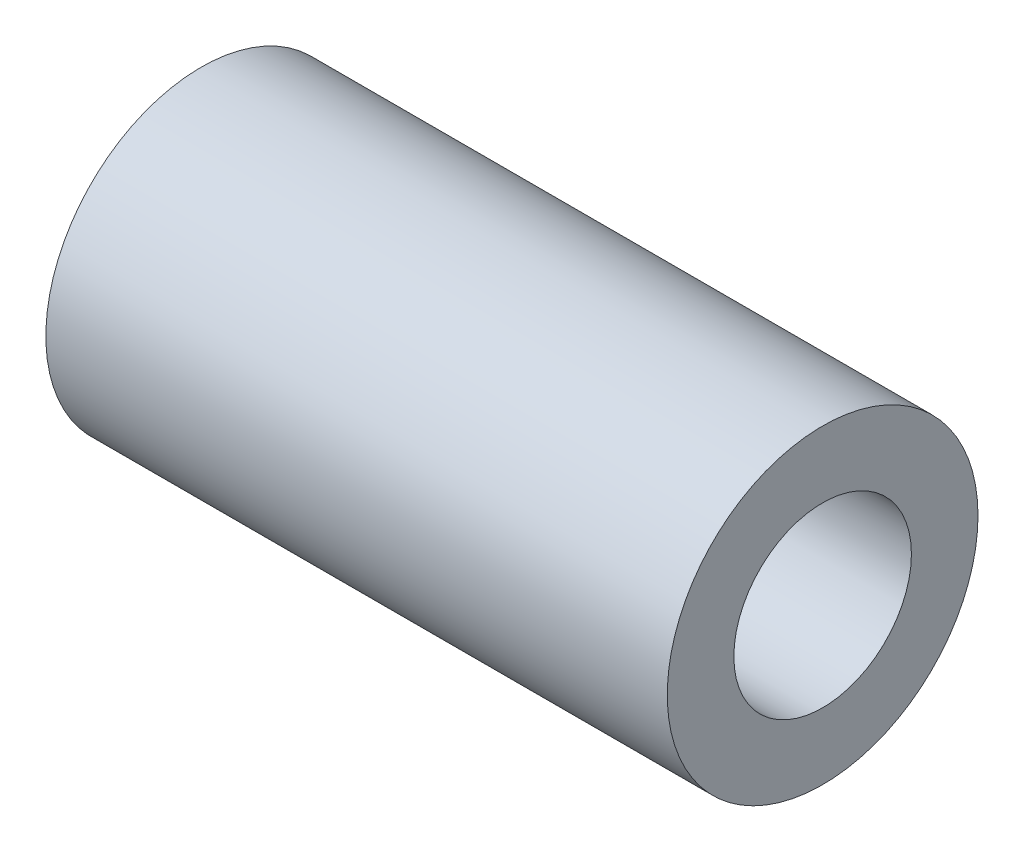
from build123d import *

# Parameters (mm, degrees)
SKETCH2_R           = 7
SKETCH2_R_2         = 4
BOSS_EXTRUDE1_DEPTH = 28


with BuildPart() as part:
    # Sketch2 → Boss-Extrude1 (new body)
    with BuildSketch(Plane(origin=(0, 0, 0), x_dir=(0, 0, -1), z_dir=(1, 0, 0))):
        Circle(SKETCH2_R)
        Circle(SKETCH2_R_2, mode=Mode.SUBTRACT)
    extrude(amount=-BOSS_EXTRUDE1_DEPTH)


solid = part.part
